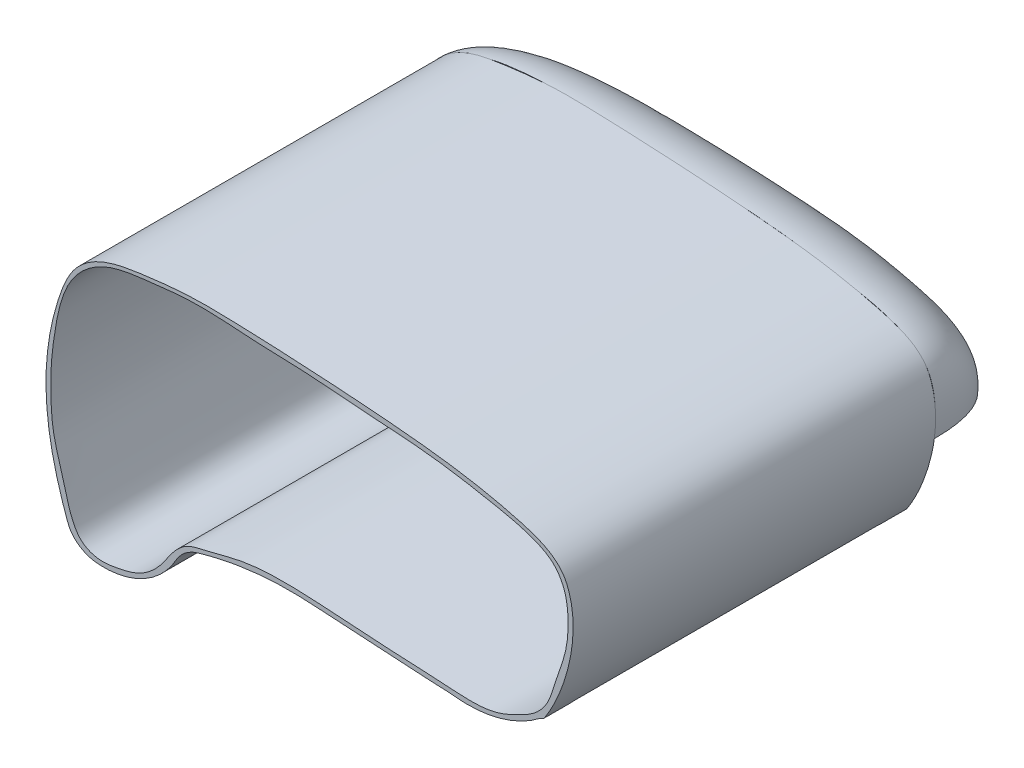
from build123d import *

# Parameters (mm, degrees)
BOSS_EXTRUDE2_DEPTH = 50
CUT_EXTRUDE4_DEPTH  = 50
REVOLVE1_ANGLE      = 90


with BuildPart() as part:
    # Sketch3 → Boss-Extrude2 (new body)
    with BuildSketch(Plane.XY):
        with BuildLine():
            add(Edge.make_bspline(
                [(-30.415758382, -23.681630619), (-26.348321099, -23.886479889), (-22.704582998, -22.067364191), (-20.423917773, -18.693260545), (-20.303957586, -18.51578684), (-20.074068144, -18.1540592), (-19.763344127, -17.587759454), (-19.507605455, -17.242933098), (-19.369227638, -17.079412633), (-18.951309705, -16.585560825), (-18.44647712, -16.180975768), (-17.873452768, -15.880662434), (-17.780320383, -15.831853169), (-17.590976311, -15.74011022), (-17.29948593, -15.613665866), (-17.098200398, -15.552767444), (-16.997452319, -15.522670769), (-16.892841031, -15.49142003), (-16.683391364, -15.429678733), (-16.368533454, -15.339346939), (-16.158208598, -15.280656179), (-16.052940937, -15.251693275), (-12.514391339, -14.278111517), (-8.900389071, -13.748665496), (-5.210934135, -13.663355209), (-4.334018044, -13.643078511), (-2.579021608, -13.652876093), (0.050480343, -13.818392433), (1.801669698, -13.922832586), (2.677264376, -13.975052662), (6.522931166, -14.204406515), (10.368597956, -14.433760368), (14.214264746, -14.66311422), (14.784012278, -14.697093709), (15.923507342, -14.765052687), (17.636186752, -14.809364724), (18.772245002, -14.934950131), (19.341992534, -14.968929619), (20.318652463, -15.027177182), (21.286280806, -14.999918078), (22.724648466, -14.835243074), (23.201911137, -14.759587105), (24.151960578, -14.565899514), (24.626882219, -14.447206618), (26.028896295, -14.029435425), (26.924862273, -13.672670179), (28.640873438, -12.805668348), (29.460962627, -12.295520711), (30.239768687, -11.701920609), (30.314250144, -11.645151405), (30.462199597, -11.530283335), (30.788371028, -11.472498656), (30.892341952, -11.316700242), (30.943710234, -11.238396159), (31.07644782, -11.036055446), (31.431730148, -10.469311038), (31.949679679, -9.539705175), (32.485514224, -8.455819208), (32.957873061, -7.376561255), (33.375511756, -6.299100454), (33.742164284, -5.220704478), (34.061564622, -4.138640997), (34.423487418, -2.686452756), (34.688081634, -1.21328872), (34.837413887, 0.292829812), (34.88222672, 1.441983327), (34.847249864, 2.612056416), (34.715763314, 3.804366513), (34.459651662, 5.013602483), (34.187251284, 5.827142506), (33.932421096, 6.400562097), (33.763700777, 6.739825609), (33.461308306, 7.220364272), (33.164941995, 7.589441371), (32.905673582, 7.865286246), (32.701246636, 8.062313067), (32.487956101, 8.24933462), (32.266631867, 8.426701757), (32.038103825, 8.594765335), (31.803201865, 8.753876205), (31.562755879, 8.904385223), (31.235582313, 9.094267151), (30.815804479, 9.312636336), (30.299652384, 9.548340449), (29.773693309, 9.761556212), (29.24053897, 9.956134186), (28.52222261, 10.194649972), (27.614400661, 10.460933506), (26.517743869, 10.755599702), (25.415990631, 11.031782135), (24.309432951, 11.289622609), (23.19836283, 11.529262923), (22.083226341, 11.751645116), (20.964469554, 11.957711225), (19.842411434, 12.148351371), (18.717370945, 12.324455672), (17.589640769, 12.487150642), (16.45951359, 12.637562793), (15.327193865, 12.776835578), (14.192886051, 12.906112451), (13.056735668, 13.026510099), (12.108529472, 13.120372691), (11.349164296, 13.192159118), (10.58928174, 13.261935656), (9.828647269, 13.328986169), (9.162447717, 13.385593923), (8.781580081, 13.417398488), (8.400591638, 13.448856658), (7.92413078, 13.487558792), (7.161308152, 13.548187276), (6.397750737, 13.606916821), (5.633444724, 13.663834337), (5.168958003, 13.697690256), (4.895543923, 13.717319871), (4.81341129, 13.723189916), (4.213556354, 13.766061734), (3.013644556, 13.848980049), (1.213223195, 13.965616804), (0.012654394, 14.038390325), (-0.587699784, 14.07358688), (-0.624457125, 14.075741828), (-0.757516537, 14.083526406), (-0.986934462, 14.096847521), (-1.372376097, 14.118983099), (-1.854451275, 14.146209245), (-2.433384876, 14.178172434), (-3.012768234, 14.209428572), (-3.592607721, 14.239978797), (-4.172910248, 14.26981553), (-4.753682728, 14.298931193), (-5.528681856, 14.336780544), (-6.498640209, 14.382251664), (-7.664585421, 14.433731815), (-8.832585898, 14.48198649), (-10.002708062, 14.526653725), (-11.175018338, 14.567371556), (-12.349591207, 14.603409917), (-13.526501152, 14.634038742), (-14.70586092, 14.654176276), (-15.887783256, 14.658740761), (-17.071903326, 14.641769134), (-18.257856294, 14.597298331), (-19.444967465, 14.525074056), (-20.632562144, 14.424842009), (-21.820832722, 14.302438232), (-23.009971593, 14.163698765), (-24.200054053, 14.009399634), (-25.391155395, 13.840316865), (-26.58144416, 13.646627506), (-27.769088884, 13.418508609), (-28.942011018, 13.108791986), (-30.089346663, 12.704070816), (-31.008307969, 12.267845103), (-31.710044059, 11.853866289), (-32.38468611, 11.39531556), (-33.168177216, 10.736230268), (-33.852484993, 9.969975994), (-34.328877112, 9.300415079), (-34.760584975, 8.599448957), (-35.22147147, 7.676168652), (-35.533950195, 6.909958399), (-35.679505506, 6.522126094), (-35.904556792, 5.922476668), (-36.211196928, 4.990290118), (-36.584565824, 3.694487729), (-36.843796725, 2.696138432), (-37.079178395, 1.671237624), (-37.28812774, 0.620739407), (-37.468061667, -0.454402113), (-37.665594984, -1.918675124), (-37.826130478, -3.802724324), (-37.868440543, -6.128774446), (-37.749719921, -8.495453452), (-37.477613484, -10.87392268), (-37.059766103, -13.235343469), (-36.517741078, -15.556015065), (-35.980541604, -17.436199777), (-35.510969927, -18.901831563), (-35.225098384, -19.736806321), (-35.058167903, -20.205782808), (-35.017195658, -20.319842932), (-34.803136907, -20.915747975), (-34.356924523, -22.101058085), (-32.307589687, -23.480433127), (-31.048142455, -23.649781716), (-30.415758382, -23.681630619)],
                knots=[0, 0, 0, 0, 0.061141334, 0.061141334, 0.061141334, 0.064659638, 0.068177943, 0.071696247, 0.071696247, 0.071696247, 0.082190597, 0.082190597, 0.082190597, 0.08391757, 0.085644544, 0.087371517, 0.087371517, 0.087371517, 0.089164711, 0.090957906, 0.0927511, 0.0927511, 0.0927511, 0.15302894, 0.15302894, 0.15302894, 0.167355883, 0.181682825, 0.196009767, 0.196009767, 0.196009767, 0.258934597, 0.258934597, 0.258934597, 0.268257107, 0.277579617, 0.286902127, 0.286902127, 0.286902127, 0.302882752, 0.302882752, 0.310873065, 0.310873065, 0.318863378, 0.318863378, 0.334844003, 0.334844003, 0.350824628, 0.350824628, 0.350824628, 0.352352942, 0.353881256, 0.355409571, 0.355409571, 0.355409571, 0.359358792, 0.36646944, 0.373580088, 0.380690737, 0.387801385, 0.394912033, 0.402022681, 0.409133329, 0.423354626, 0.430465274, 0.437575922, 0.44468657, 0.451797219, 0.458907867, 0.466018515, 0.466018515, 0.4690858, 0.472153085, 0.475220371, 0.476754013, 0.478287656, 0.479821298, 0.481354941, 0.482888583, 0.484422226, 0.485955869, 0.487489511, 0.490556796, 0.493624081, 0.496691367, 0.499758652, 0.502825937, 0.508960507, 0.515095077, 0.521229648, 0.527364218, 0.533498788, 0.539633359, 0.545767929, 0.551902499, 0.558037069, 0.56417164, 0.57030621, 0.57644078, 0.582575351, 0.588709921, 0.594844491, 0.597911776, 0.600979061, 0.607113632, 0.610180917, 0.611714559, 0.613248202, 0.616315487, 0.619382772, 0.625517343, 0.628584628, 0.631651913, 0.632968678, 0.632968678, 0.632968678, 0.642585658, 0.652202638, 0.661819618, 0.661819618, 0.661819618, 0.662408428, 0.663950925, 0.665493422, 0.668578415, 0.671663408, 0.674748402, 0.677833395, 0.680918388, 0.684003382, 0.687088375, 0.693258361, 0.699428348, 0.705598335, 0.711768321, 0.717938308, 0.724108295, 0.730278281, 0.736448268, 0.742618254, 0.748788241, 0.754958228, 0.761128214, 0.767298201, 0.773468188, 0.779638174, 0.785808161, 0.791978148, 0.798148134, 0.804318121, 0.810488107, 0.816658094, 0.822828081, 0.825913074, 0.828998067, 0.835168054, 0.841338041, 0.844423034, 0.847508027, 0.853678014, 0.859848, 0.859848, 0.859848, 0.869387765, 0.874157648, 0.87892753, 0.883697412, 0.888467295, 0.893237177, 0.898007059, 0.907546824, 0.917086589, 0.926626353, 0.936166118, 0.945705883, 0.955245648, 0.964785412, 0.969555295, 0.974325177, 0.97586504, 0.97586504, 0.97586504, 0.983910027, 0.991955013, 1, 1, 1, 1], degree=3, weights=[1, 0.914065019, 0.914065019, 1, 1, 1, 1, 1, 1, 0.987637563, 0.987637563, 1, 1, 1, 1, 1, 1, 1, 1, 1, 1, 1, 1, 1, 1, 1, 1, 1, 1, 1, 1, 1, 1, 1, 1, 1, 1, 1, 1, 1, 1, 1, 1, 1, 1, 1, 1, 1, 1, 1, 1, 1, 1, 1, 1, 1, 1, 1, 1, 1, 1, 1, 1, 1, 1, 1, 1, 1, 1, 1, 1, 1, 1, 1, 1, 1, 1, 1, 1, 1, 1, 1, 1, 1, 1, 1, 1, 1, 1, 1, 1, 1, 1, 1, 1, 1, 1, 1, 1, 1, 1, 1, 1, 1, 1, 1, 1, 1, 1, 1, 1, 1, 1, 1, 1, 1, 1, 1, 1, 1, 1, 1, 1, 1, 1, 1, 1, 1, 1, 1, 1, 1, 1, 1, 1, 1, 1, 1, 1, 1, 1, 1, 1, 1, 1, 1, 1, 1, 1, 1, 1, 1, 1, 1, 1, 1, 1, 1, 1, 1, 1, 1, 1, 1, 1, 1, 1, 1, 1, 1, 1, 1, 1, 1, 1, 1, 1, 1, 1, 1, 1, 1, 1, 1, 1, 1]))
        make_face()
    extrude(amount=BOSS_EXTRUDE2_DEPTH)

    # Sketch9 → Cut-Extrude4 (cut)
    with BuildSketch(Plane(origin=(0, 0, 0), x_dir=(-1, 0, 0), z_dir=(0, 0, -1))):
        with BuildLine():
            add(Edge.make_bspline(
                [(-34.128938402, 2.807156483), (-34.23919806, 1.34625687), (-34.130732831, -1.212551892), (-33.109009727, -4.270429095), (-32.213409492, -6.809035816), (-31.546634004, -9.246000082), (-29.746576608, -11.448717571), (-27.194659146, -12.802800288), (-24.160848528, -14.219418834), (-20.30313659, -14.453035051), (-16.40256201, -14.07949284), (-12.007669144, -13.962969625), (-7.325474561, -13.638315676), (-2.556262007, -13.366680004), (1.662037873, -13.06756211), (6.215977435, -12.95736404), (10.888080615, -13.276358918), (15.146716764, -14.586808759), (18.387108225, -15.131721525), (20.545074768, -17.201765257), (22.071920562, -19.886247437), (24.75767034, -22.134775285), (27.952191868, -22.878127932), (30.651183352, -23.286104486), (33.323950133, -22.167483414), (34.701102014, -19.18067588), (35.582372896, -15.347061407), (36.94918893, -11.290256164), (37.179843444, -7.291052812), (37.224137907, -3.361515139), (36.543369085, 2.162033908), (35.237574015, 8.505920076), (29.740319486, 12.82421811), (23.773406881, 13.551844868), (16.541768031, 14.41038465), (9.228076491, 13.648563581), (1.737078452, 13.57744032), (-5.373018637, 12.839240757), (-12.692063708, 12.528282325), (-19.026331478, 11.697590596), (-24.457605724, 10.645730346), (-28.693548941, 9.775047728), (-32.238466867, 8.059899122), (-33.797716965, 5.48006468), (-34.062555368, 3.686707095), (-34.128938402, 2.807156483)],
                knots=[0, 0, 0, 0, 0.023300271, 0.040372558, 0.051295107, 0.066460744, 0.080358721, 0.095259801, 0.112321414, 0.13347422, 0.155863194, 0.175166656, 0.203705975, 0.230932869, 0.251571762, 0.271299777, 0.303880157, 0.325553841, 0.343002218, 0.354715827, 0.371807664, 0.392562291, 0.408082384, 0.423886688, 0.435416362, 0.451508206, 0.47347859, 0.499301636, 0.519190671, 0.537282394, 0.561980563, 0.608951624, 0.634674953, 0.667939242, 0.703139053, 0.751397709, 0.784732238, 0.822979115, 0.865596878, 0.901841125, 0.925029301, 0.954008699, 0.971208976, 0.985971817, 1, 1, 1, 1], degree=3))
        make_face()
    extrude(amount=-CUT_EXTRUDE4_DEPTH, mode=Mode.SUBTRACT)

    # Sketch17 → Revolve1 (revolve)
    with BuildSketch(Plane(origin=(0, 0, 0), x_dir=(-1, 0, 0), z_dir=(0, 0, -1))):
        with BuildLine():
            Line((-34.686779334, -1.055904934), (35.626433519, 6.662071921))
            add(Edge.make_bspline(
                [(-34.686779334, -1.055904934), (-34.945910745, 1.482613627), (-35.178328319, 6.956620398), (-29.334629699, 10.198026942), (-23.676631827, 11.465764664), (-16.14663014, 12.81187247), (-7.752882482, 13.527842825), (0.620960207, 14.098395826), (9.418546273, 14.540821153), (18.079360164, 14.764646867), (28.077291353, 13.836680328), (34.58012547, 10.982296548), (35.626433519, 6.662071921)],
                knots=[0, 0, 0, 0, 0.105545019, 0.158728989, 0.229400312, 0.320597008, 0.43844085, 0.538740285, 0.62864489, 0.762132669, 0.855321835, 1, 1, 1, 1], degree=3))
        make_face()
    revolve(axis=Axis((34.686779334, -1.055904934, 0), (-0.9940296454710931, 0.10911032913804808, 0)), revolution_arc=REVOLVE1_ANGLE)


solid = part.part
